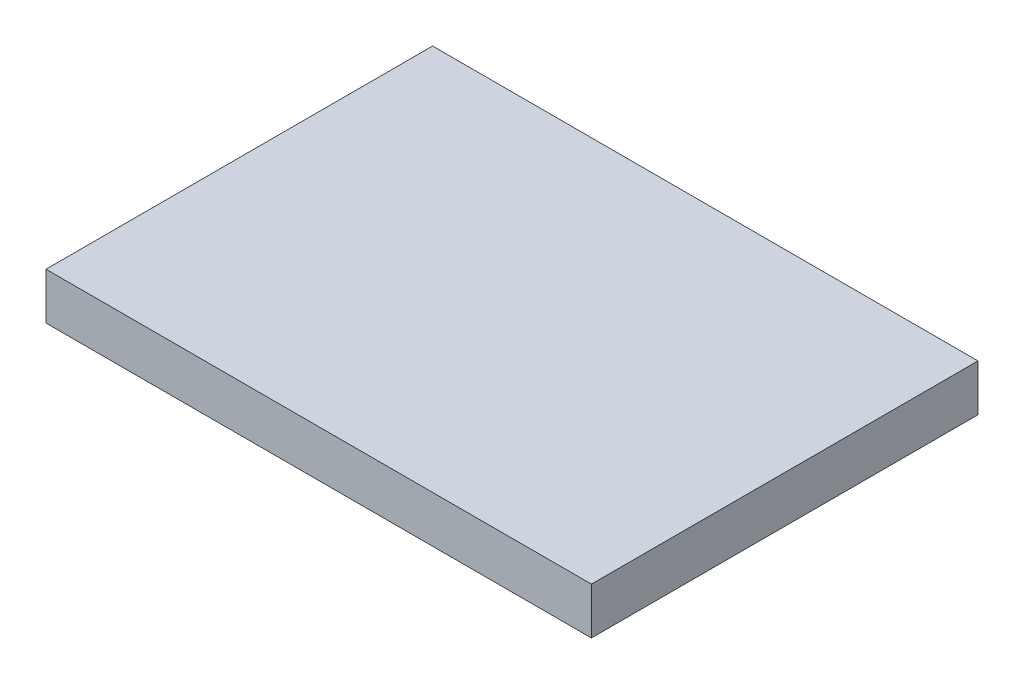
from build123d import *

# Parameters (mm, degrees)
SKETCH1_W      = 106.314849721
SKETCH1_H      = 12.827670378
EXTRUDE1_DEPTH = 150


with BuildPart() as part:
    # Sketch1 → Extrude1 (new body)
    with BuildSketch(Plane(origin=(0, 0, 0), x_dir=(0, 0, -1), z_dir=(1, 0, 0))):
        with Locations((53.157424861, 6.413835189)):
            Rectangle(SKETCH1_W, SKETCH1_H)
    extrude(amount=EXTRUDE1_DEPTH)


solid = part.part
